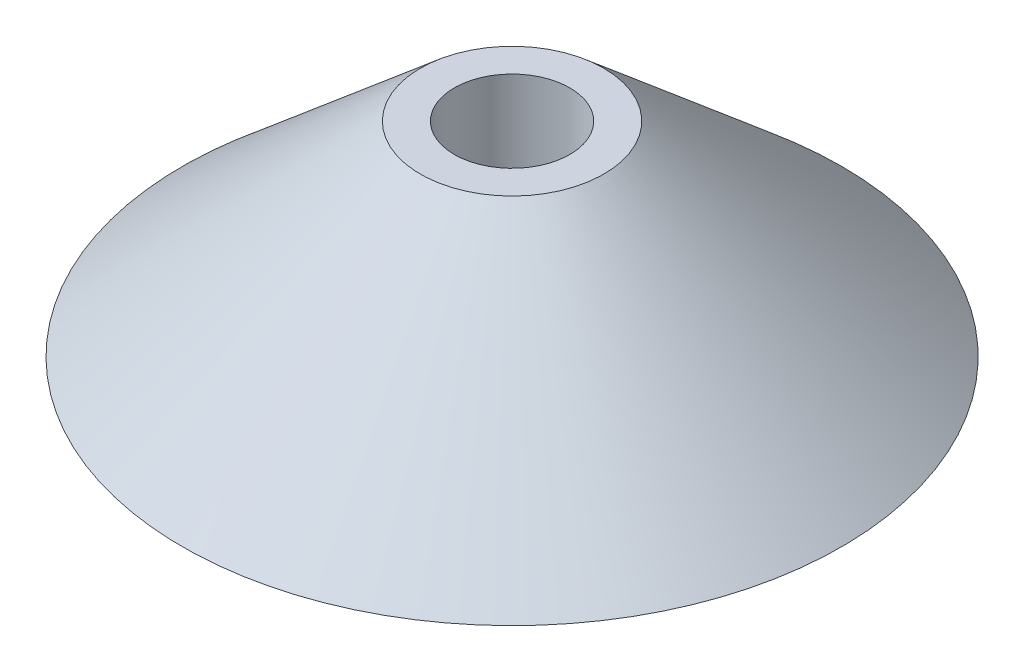
from build123d import *


with BuildPart() as part:
    # Sketch1 → Revolve1 (revolve)
    with BuildSketch(Plane.XY, mode=Mode.PRIVATE) as revolve1_sk:
        Polygon((-2.7, 6), (-9.7, 0), (-1.7, 0), (-1.7, 6), align=None)
    revolve(revolve1_sk.sketch.rotate(Axis((0, 11.326530612, 0), (0, -1, 0)), 270), axis=Axis((0, 11.326530612, 0), (0, -1, 0)))


solid = part.part
